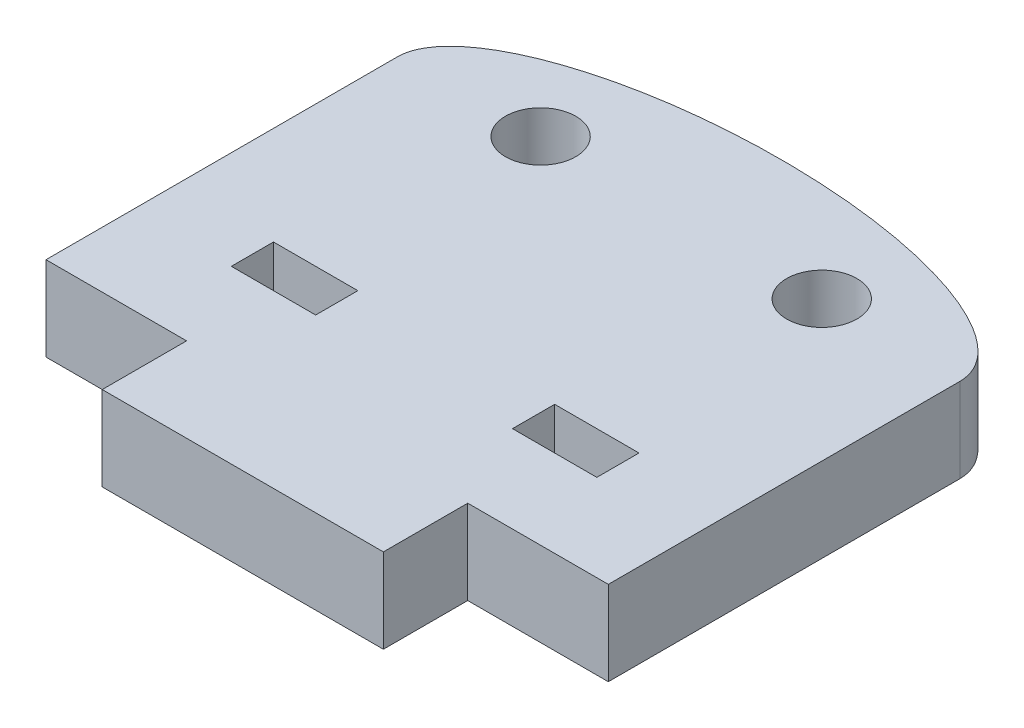
from build123d import *

# Parameters (mm, degrees)
SKETCH1_R           = 2.5
SKETCH1_W           = 6
SKETCH1_H           = 3
BOSS_EXTRUDE1_DEPTH = 6


with BuildPart() as part:
    # Sketch1 → Boss-Extrude1 (new body)
    with BuildSketch(Plane(origin=(0, 0, 0), x_dir=(1, 0, 0), z_dir=(0, 1, 0))):
        with BuildLine():
            Line((-30, -0.182836164), (-30, -25.182836164))
            Line((-30, -25.182836164), (-20, -25.182836164))
            Line((-20, -25.182836164), (-20, -31.182836164))
            Line((-20, -31.182836164), (0, -31.182836164))
            Line((0, -31.182836164), (0, -25.182836164))
            Line((0, -25.182836164), (10, -25.182836164))
            Line((10, -25.182836164), (10, -0.182836164))
            add(Edge.make_bspline(
                [(10, -0.182836164), (10, 7.134318013), (-10, 7.134318013), (-30, 7.134318013), (-30, -0.182836164)],
                knots=[0, 0, 0, 1.570796327, 1.570796327, 3.141592654, 3.141592654, 3.141592654], degree=2, weights=[1, 0.707106781, 1, 0.707106781, 1]))
        make_face()
        with Locations(Location((0, 0, 0), (0, 0, 270))):
            Circle(SKETCH1_R, mode=Mode.SUBTRACT)
        with Locations(Location((-20, 0, 0), (0, 0, 270))):
            Circle(SKETCH1_R, mode=Mode.SUBTRACT)
        with Locations((0, -17.5)):
            Rectangle(SKETCH1_W, SKETCH1_H, mode=Mode.SUBTRACT)
        with Locations((-20, -17.5)):
            Rectangle(SKETCH1_W, SKETCH1_H, mode=Mode.SUBTRACT)
    extrude(amount=BOSS_EXTRUDE1_DEPTH)


solid = part.part
